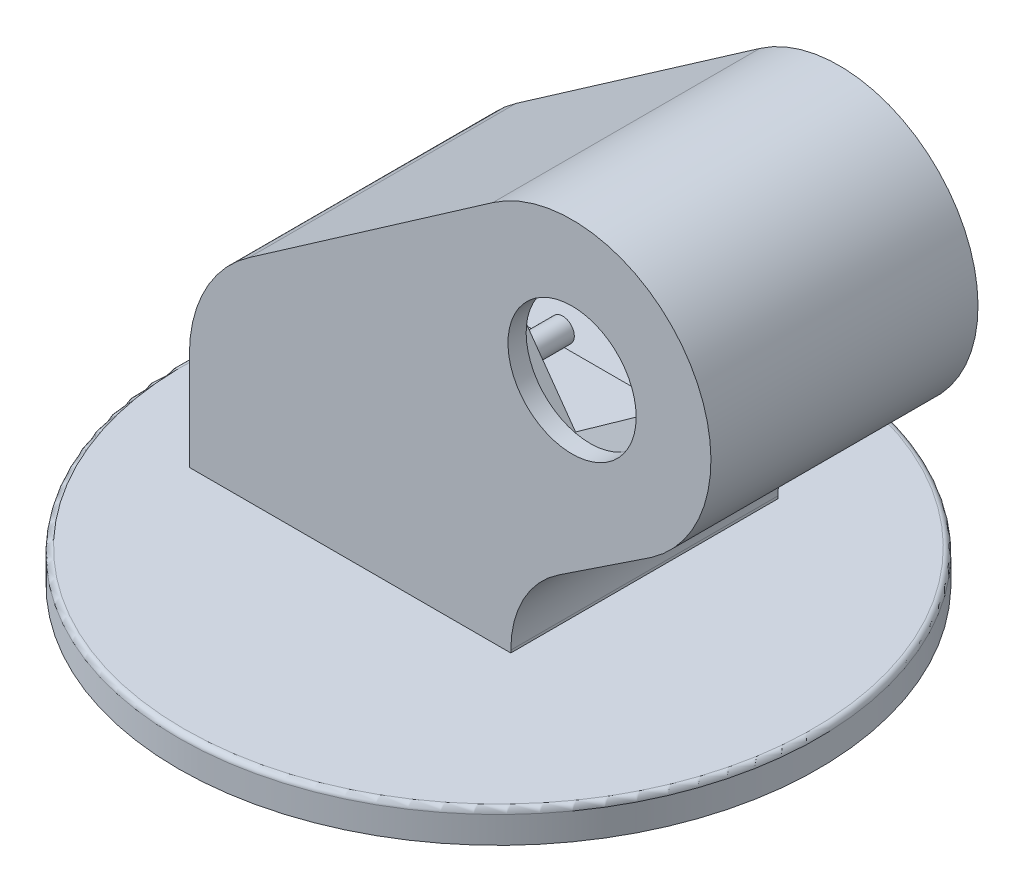
from build123d import *

# Parameters (mm, degrees)
SKETCH1_R                = 29.95
BOSS_EXTRUDE1_DEPTH      = 3
FILLET1_R                = 0.5
BOSS_EXTRUDE2_DEPTH      = 8
BOSS_EXTRUDE2_DEPTH_BACK = 17
SKETCH3_R                = 6
CUT_EXTRUDE2_DEPTH       = 14.3
CUT_EXTRUDE4_START       = -14.3
CUT_EXTRUDE4_DEPTH       = 9
SKETCH7_R                = 1.0925
BOSS_EXTRUDE3_DEPTH      = 4
BOSS_EXTRUDE4_DEPTH      = 2


with BuildPart() as part:
    # Sketch1 → Boss-Extrude1 (new body)
    with BuildSketch(Plane(origin=(0, 0, 0), x_dir=(1, 0, 0), z_dir=(0, 1, 0))):
        with Locations(Location((0, 0, 0), (0, 0, 270))):
            Circle(SKETCH1_R)
    extrude(amount=BOSS_EXTRUDE1_DEPTH)

    # Fillet1
    fillet1_edges = [part.edges().sort_by_distance(p)[0] for p in [
        (0, 3, -29.95),
    ]]
    fillet(fillet1_edges, radius=FILLET1_R)

    # Sketch3 → Boss-Extrude2 (add, two sides: drawn at the far end of the back side and taken through both)
    with BuildSketch(Plane.XY.offset(-BOSS_EXTRUDE2_DEPTH_BACK)):
        with BuildLine():
            ThreePointArc((22.319611022, 17.326801635), (25.571028156, 35.421781232), (7.476048559, 38.673198365))
            Line((7.476048559, 38.673198365), (-15.351755113, 22.799515608))
            ThreePointArc((-15.351755113, 22.799515608), (-19.451327013, 18.1478139), (-20.929973881, 12.126317243))
            Line((-20.929973881, 12.126317243), (-20.929973881, 3))
            Line((-20.929973881, 3), (9.161240081, 3))
            Line((9.161240081, 3), (9.161240081, 3.233006236))
            ThreePointArc((9.161240081, 3.233006236), (10.350199335, 7.962230378), (13.634352277, 11.566883557))
            Line((13.634352277, 11.566883557), (22.319611022, 17.326801635))
        make_face()
        with Locations((14.897829791, 28)):
            Circle(SKETCH3_R, mode=Mode.SUBTRACT)
    extrude(amount=BOSS_EXTRUDE2_DEPTH + BOSS_EXTRUDE2_DEPTH_BACK)

    # Sketch5 → Cut-Extrude2 (cut)
    with BuildSketch(Plane(origin=(0, 0, -17), x_dir=(-1, 0, 0), z_dir=(0, 0, -1))):
        with BuildLine():
            Line((-8.626514029, 37.037178687), (14.430028566, 21.037178687))
            ThreePointArc((14.430028566, 21.037178687), (17.905108892, 17.099780712), (19.158712805, 12))
            Line((19.158712805, 12), (19.158712805, 5.262193484))
            Line((19.158712805, 5.262193484), (-7.161240081, 5.262193484))
            Line((-7.161240081, 5.262193484), (-7.161240081, 5.56341477))
            ThreePointArc((-7.161240081, 5.56341477), (-8.137033641, 9.392321128), (-10.826371055, 12.287171944))
            Line((-10.826371055, 12.287171944), (-20.858274701, 18.754833886))
            ThreePointArc((-20.858274701, 18.754833886), (-24.040323598, 34.116764421), (-8.626514029, 37.037178687))
        make_face()
    extrude(amount=-CUT_EXTRUDE2_DEPTH, mode=Mode.SUBTRACT)

    # Sketch4 → Cut-Extrude4 (cut)
    with BuildSketch(Plane(origin=(0, 0, -17), x_dir=(-1, 0, 0), z_dir=(0, 0, -1)).offset(CUT_EXTRUDE4_START)):
        Polygon((-23.261597646, 26.588590728), (-4.523766462, 13.250911675), (2.435022609, 23.027171423), (-16.302808575, 36.364850476), align=None)
    extrude(amount=-CUT_EXTRUDE4_DEPTH, mode=Mode.SUBTRACT)

    # Sketch7 → Boss-Extrude3 (add)
    with BuildSketch(Plane(origin=(0, 0, -2.7), x_dir=(-1, 0, 0), z_dir=(0, 0, -1))):
        with Locations((-21.488975125, 32.691609194)):
            Circle(SKETCH7_R)
        with Locations((0.684110702, 16.95524562)):
            Circle(SKETCH7_R)
    extrude(amount=BOSS_EXTRUDE3_DEPTH)

    # Sketch8 → Boss-Extrude4 (add)
    with BuildSketch(Plane.XZ):
        with BuildLine():
            Line((4.419624532, 5.457754962), (-15.163378573, 4.241831176))
            ThreePointArc((-15.163378573, 4.241831176), (-19.147983311, 0.130911389), (-15.424074318, -4.217564002))
            Line((-15.424074318, -4.217564002), (-14.905016784, -4.249997039))
            Line((-14.905016784, -4.249997039), (4.41534389, -5.457219623))
            Line((4.41534389, -5.457219623), (5.1, -5.5))
            ThreePointArc((5.1, -5.5), (10.6, 0), (5.1, 5.5))
            Line((5.1, 5.5), (4.419624532, 5.457754962))
        make_face()
        with BuildLine():
            Line((-14.9, 2.25), (4.880474733, 3.493108738))
            ThreePointArc((4.880474733, 3.493108738), (8.6, 0), (4.880474733, -3.493108738))
            Line((4.880474733, -3.493108738), (-14.9, -2.25))
            ThreePointArc((-14.9, -2.25), (-17.15, 0), (-14.9, 2.25))
        make_face(mode=Mode.SUBTRACT)
    extrude(amount=BOSS_EXTRUDE4_DEPTH)


solid = part.part
